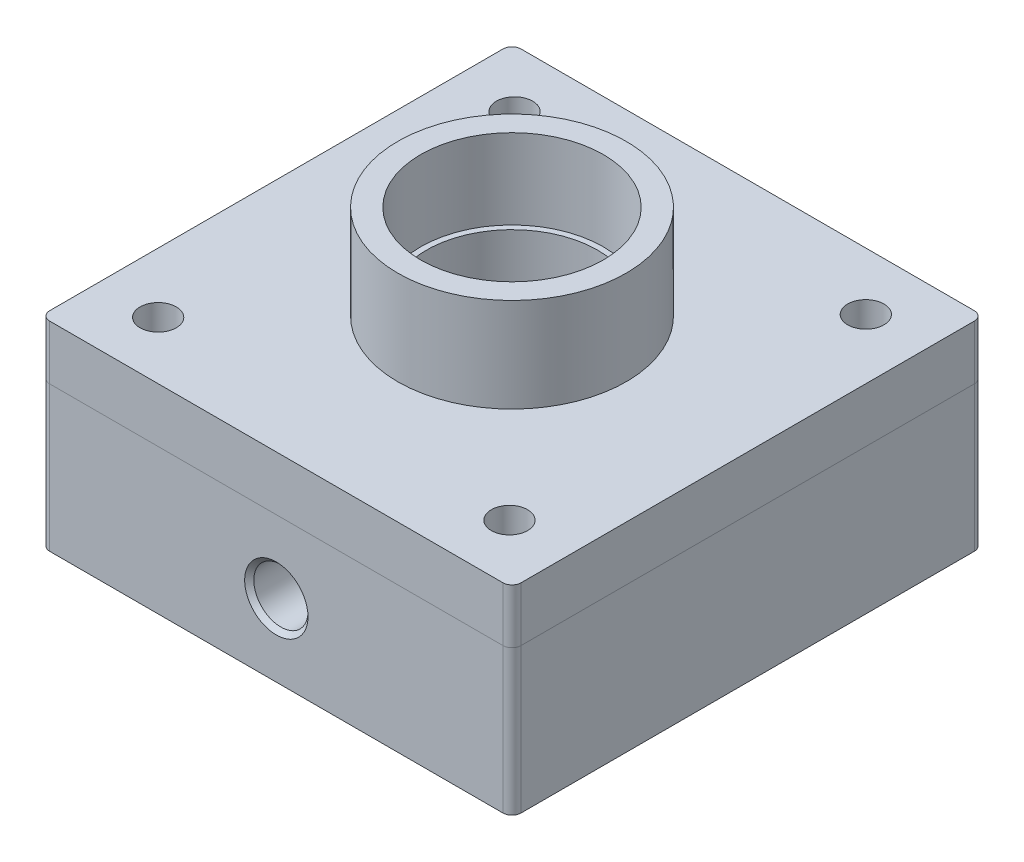
from build123d import *

# Parameters (mm, degrees)
SKETCH1_W                              = 165.1
SKETCH1_H                              = 165.1
BOSS_EXTRUDE1_DEPTH                    = 50.8
SKETCH2_R                              = 40
BOSS_EXTRUDE2_DEPTH                    = 52
SKETCH3_R                              = 32
CUT_EXTRUDE1_DEPTH                     = 28
SKETCH4_R                              = 30
CUT_EXTRUDE2_DEPTH                     = 22
FILLET1_R                              = 3.175
SKETCH5_R                              = 20
CUT_EXTRUDE3_DEPTH                     = 40
SKETCH6_R                              = 76.2
SKETCH6_R_2                            = 69.85
CUT_EXTRUDE4_DEPTH                     = 8
F_1_2_14_NPSM_TAPPED_HOLE1_D           = 18.9738
F_1_2_14_NPSM_TAPPED_HOLE1_DEPTH       = 47.24
F_1_2_14_NPSM_TAPPED_HOLE1_CSINK_D     = 22.1742
F_1_2_14_NPSM_TAPPED_HOLE1_CSINK_ANGLE = 90
F_1_2_14_NPSM_TAPPED_HOLE1_TIP         = 5.700304607
SKETCH10_R                             = 6.35
CUT_EXTRUDE5_DEPTH                     = 25
SKETCH11_R                             = 6.35
CUT_EXTRUDE6_DEPTH                     = 156.553350976
SKETCH12_R                             = 6.35
SKETCH12_R_2                           = 40
BOSS_EXTRUDE4_DEPTH                    = 19.05


with BuildPart() as part:
    # Sketch1 → Boss-Extrude1 (new body)
    with BuildSketch(Plane(origin=(0, 0, 0), x_dir=(1, 0, 0), z_dir=(0, 1, 0))):
        Rectangle(SKETCH1_W, SKETCH1_H)
    extrude(amount=BOSS_EXTRUDE1_DEPTH)

    # Sketch2 → Boss-Extrude2 (add)
    with BuildSketch(Plane(origin=(0, 50.8, 0), x_dir=(1, 0, 0), z_dir=(0, 1, 0))):
        with Locations(Location((0, 0, 0), (0, 0, 90))):
            Circle(SKETCH2_R)
    extrude(amount=BOSS_EXTRUDE2_DEPTH)

    # Sketch3 → Cut-Extrude1 (cut)
    with BuildSketch(Plane(origin=(0, 102.8, 0), x_dir=(1, 0, 0), z_dir=(0, 1, 0))):
        with Locations(Location((0, 0, 0), (0, 0, 270))):
            Circle(SKETCH3_R)
    extrude(amount=-CUT_EXTRUDE1_DEPTH, mode=Mode.SUBTRACT)

    # Sketch4 → Cut-Extrude2 (cut)
    with BuildSketch(Plane(origin=(0, 74.8, 0), x_dir=(1, 0, 0), z_dir=(0, 1, 0))):
        with Locations(Location((0, 0, 0), (0, 0, 270))):
            Circle(SKETCH4_R)
    extrude(amount=-CUT_EXTRUDE2_DEPTH, mode=Mode.SUBTRACT)

    # Fillet1
    fillet1_edges = [part.edges().sort_by_distance(p)[0] for p in [
        (82.55, 25.4, 82.55),
        (-82.55, 25.4, 82.55),
        (-82.55, 25.4, -82.55),
        (82.55, 25.4, -82.55),
    ]]
    fillet(fillet1_edges, radius=FILLET1_R)

    # Sketch5 → Cut-Extrude3 (cut)
    with BuildSketch(Plane.XZ):
        with Locations(Location((0, 0, 0), (0, 0, 270))):
            Circle(SKETCH5_R)
    extrude(amount=-CUT_EXTRUDE3_DEPTH, mode=Mode.SUBTRACT)

    # Sketch6 → Cut-Extrude4 (cut)
    with BuildSketch(Plane.XZ):
        with Locations(Location((0, 0, 0), (0, 0, 270))):
            Circle(SKETCH6_R)
        with Locations(Location((0, 0, 0), (0, 0, 270))):
            Circle(SKETCH6_R_2, mode=Mode.SUBTRACT)
    extrude(amount=-CUT_EXTRUDE4_DEPTH, mode=Mode.SUBTRACT)

    # 1/2-14 NPSM Tapped Hole1
    with Locations(Plane.XY.offset(82.55)):
        with Locations((0, 25.4)):
            CounterSinkHole(F_1_2_14_NPSM_TAPPED_HOLE1_D / 2, F_1_2_14_NPSM_TAPPED_HOLE1_CSINK_D / 2, depth=F_1_2_14_NPSM_TAPPED_HOLE1_DEPTH, counter_sink_angle=F_1_2_14_NPSM_TAPPED_HOLE1_CSINK_ANGLE)
            with Locations((0, 0, -(F_1_2_14_NPSM_TAPPED_HOLE1_DEPTH + F_1_2_14_NPSM_TAPPED_HOLE1_TIP / 2))):  # 118° drill point
                Cone(0, F_1_2_14_NPSM_TAPPED_HOLE1_D / 2, F_1_2_14_NPSM_TAPPED_HOLE1_TIP, mode=Mode.SUBTRACT)

    # Sketch10 → Cut-Extrude5 (cut)
    with BuildSketch(Plane.XZ):
        with Locations(Location((0, 50.55, 0), (0, 0, 270))):
            Circle(SKETCH10_R)
    extrude(amount=-CUT_EXTRUDE5_DEPTH, mode=Mode.SUBTRACT)

    # Sketch11 → Cut-Extrude6 (cut, through all)
    with BuildSketch(Plane.XZ):
        with Locations(Location((-61.526164581, 62.412343907, 0), (0, 0, 270))):
            Circle(SKETCH11_R)
        with Locations(Location((61.526164581, 62.412343907, 0), (0, 0, 270))):
            Circle(SKETCH11_R)
        with Locations(Location((-61.526164581, -62.412343907, 0), (0, 0, 270))):
            Circle(SKETCH11_R)
        with Locations(Location((61.526164581, -62.412343907, 0), (0, 0, 270))):
            Circle(SKETCH11_R)
    extrude(amount=-CUT_EXTRUDE6_DEPTH, mode=Mode.SUBTRACT)


with BuildPart() as body_2:
    # Sketch12 → Boss-Extrude4 (new body)
    with BuildSketch(Plane(origin=(0, 50.8, 0), x_dir=(1, 0, 0), z_dir=(0, 1, 0))):
        with BuildLine():
            Line((-82.55, 79.375), (-82.55, -79.375))
            ThreePointArc((-82.55, -79.375), (-81.62006403, -81.62006403), (-79.375, -82.55))
            Line((-79.375, -82.55), (79.375, -82.55))
            ThreePointArc((79.375, -82.55), (81.62006403, -81.62006403), (82.55, -79.375))
            Line((82.55, -79.375), (82.55, 79.375))
            ThreePointArc((82.55, 79.375), (81.62006403, 81.62006403), (79.375, 82.55))
            Line((79.375, 82.55), (-79.375, 82.55))
            ThreePointArc((-79.375, 82.55), (-81.62006403, 81.62006403), (-82.55, 79.375))
        make_face()
        with Locations(Location((61.526164581, 62.412343907, 0), (0, 0, 270))):
            Circle(SKETCH12_R, mode=Mode.SUBTRACT)
        with Locations(Location((0, 0, 0), (0, 0, 270))):
            Circle(SKETCH12_R_2, mode=Mode.SUBTRACT)
        with Locations(Location((61.526164581, -62.412343907, 0), (0, 0, 270))):
            Circle(SKETCH12_R, mode=Mode.SUBTRACT)
        with Locations(Location((-61.526164581, -62.412343907, 0), (0, 0, 270))):
            Circle(SKETCH12_R, mode=Mode.SUBTRACT)
        with Locations(Location((-61.526164581, 62.412343907, 0), (0, 0, 270))):
            Circle(SKETCH12_R, mode=Mode.SUBTRACT)
    extrude(amount=BOSS_EXTRUDE4_DEPTH)


solid = Compound([part.part, body_2.part])
